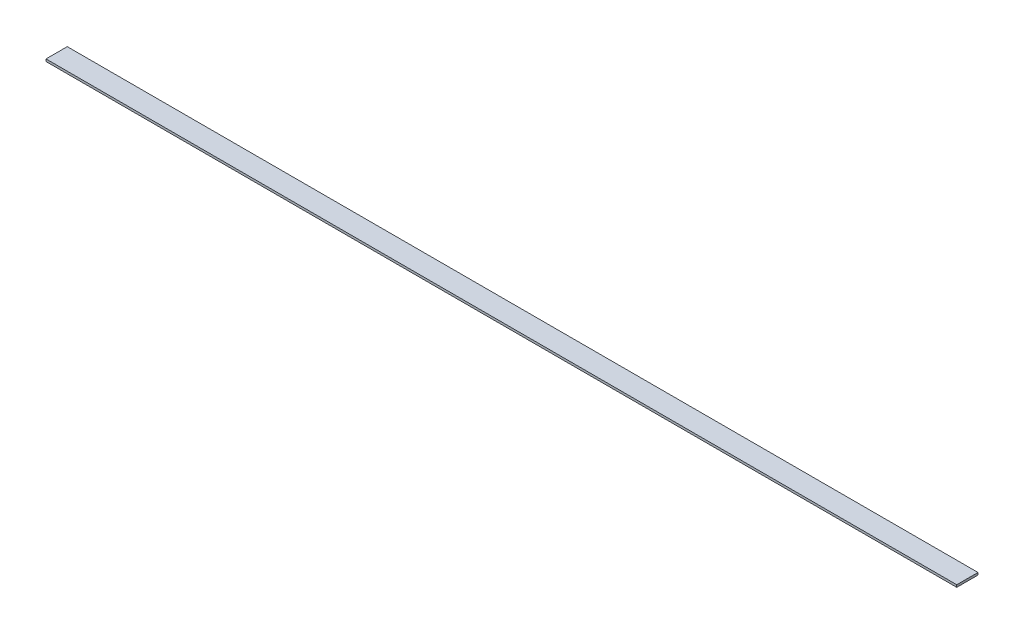
from build123d import *

# Parameters (mm, degrees)
SKETCH_1_W      = 300
SKETCH_1_H      = 7
EXTRUDE_1_DEPTH = 0.75


with BuildPart() as part:
    # Эскиз1 → Бобышка-Вытянуть1 (new body)
    with BuildSketch(Plane(origin=(0, 0, 0), x_dir=(1, 0, 0), z_dir=(0, 1, 0))):
        with Locations((150, 3.5)):
            Rectangle(SKETCH_1_W, SKETCH_1_H)
    extrude(amount=EXTRUDE_1_DEPTH)


solid = part.part
